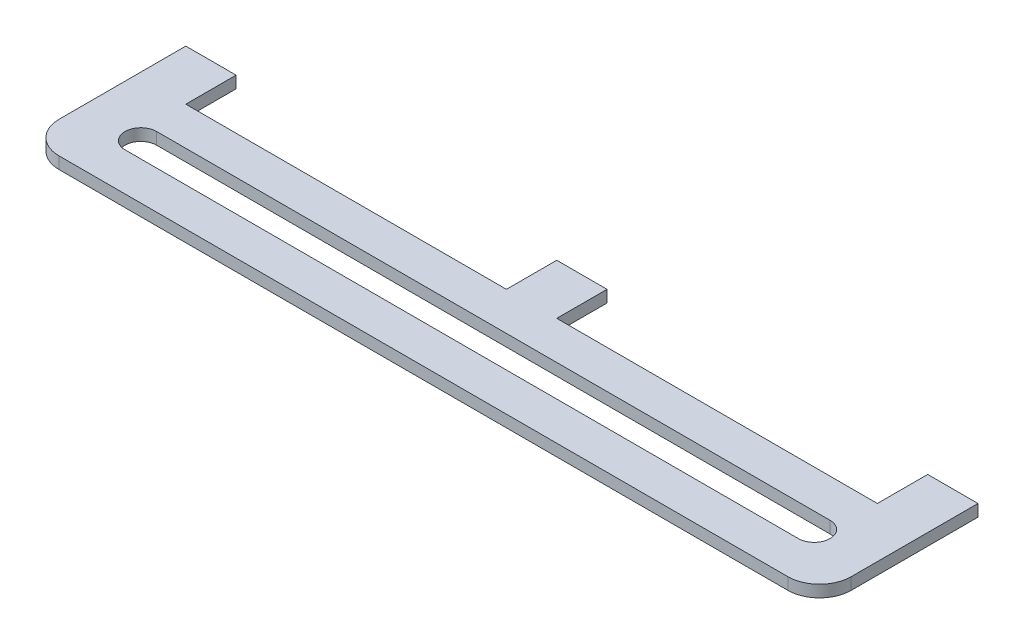
from build123d import *

# Parameters (mm, degrees)
SKETCH1_W           = 12.7
SKETCH1_H           = 12.7
BOSS_EXTRUDE1_DEPTH = 3


with BuildPart() as part:
    # Sketch1 → Boss-Extrude1 (new body)
    # profile 1 of 2: a face of its own
    with BuildSketch(Plane(origin=(0, 0, 0), x_dir=(1, 0, 0), z_dir=(0, 1, 0))):
        with BuildLine():
            ThreePointArc((-92, -20), (-97.656854249, -17.656854249), (-100, -12))
            Line((-100, -12), (-100, 20))
            Line((-100, 20), (-87.3, 20))
            Line((-87.3, 20), (-87.3, 7.3))
            Line((-87.3, 7.3), (87.3, 7.3))
            Line((87.3, 7.3), (87.3, 20))
            Line((87.3, 20), (100, 20))
            Line((100, 20), (100, -12))
            ThreePointArc((100, -12), (97.656854249, -17.656854249), (92, -20))
            Line((92, -20), (-92, -20))
        make_face()
        with BuildLine():
            ThreePointArc((85, -10.35), (89, -6.35), (85, -2.35))
            Line((85, -2.35), (-85, -2.35))
            ThreePointArc((-85, -2.35), (-89, -6.35), (-85, -10.35))
            Line((-85, -10.35), (85, -10.35))
        make_face(mode=Mode.SUBTRACT)
    # profile 2 of 2: a face of its own
    with BuildSketch(Plane(origin=(0, 0, 0), x_dir=(1, 0, 0), z_dir=(0, 1, 0))):
        with Locations((0, 13.65)):
            Rectangle(SKETCH1_W, SKETCH1_H)
    extrude(amount=BOSS_EXTRUDE1_DEPTH)


solid = part.part
